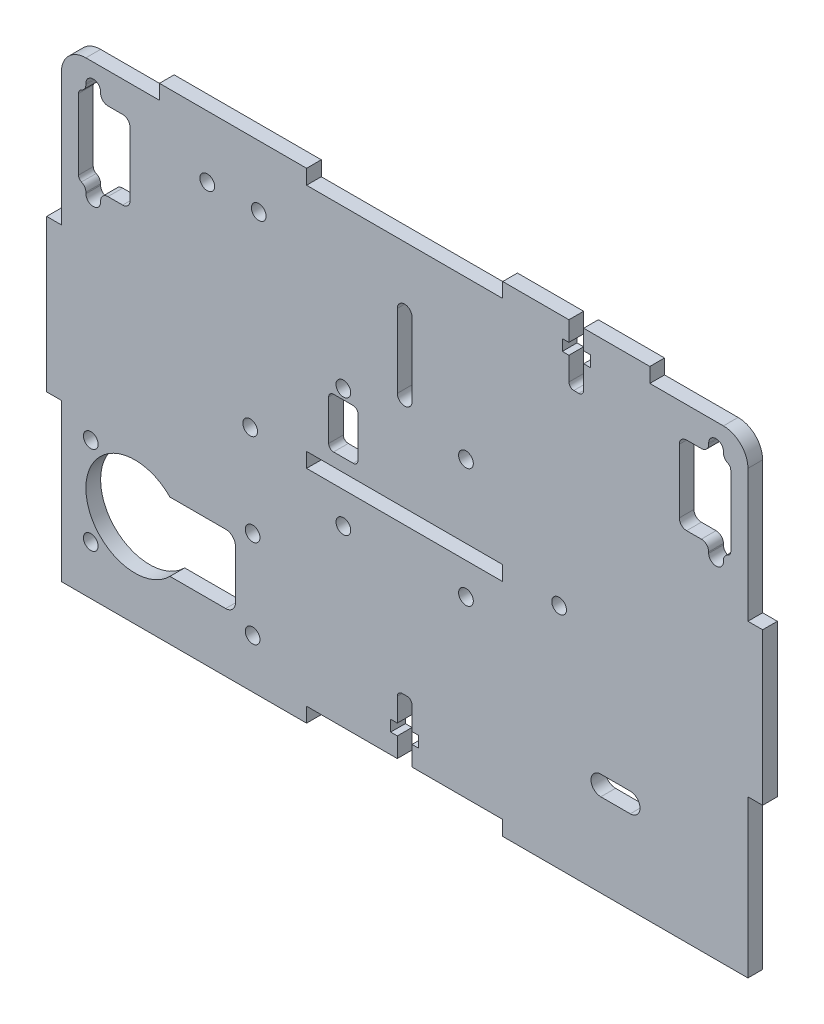
from build123d import *

# Parameters (mm, degrees)
ESBO_O1_W                   = 140
ESBO_O1_H                   = 95
RESSALTO_EXTRUS_O1_DEPTH    = 1.5
ESBO_O2_R                   = 1.5
ESBO_O2_W                   = 40
ESBO_O2_H                   = 3
CORTE_EXTRUS_O1_DEPTH       = 85.647799735
CUT_EXTRUDE12_DEPTH         = 85.607919251
CUT_EXTRUDE12_DEPTH_BACK    = 85.607919251
ESBO_O3_W                   = 3
ESBO_O3_H                   = 31
ESBO_O3_W_2                 = 30
ESBO_O3_H_2                 = 3
RESSALTO_EXTRUS_O2_DEPTH    = 3
CORTE_EXTRUS_O11_DEPTH      = 89.815820663
CORTE_EXTRUS_O11_DEPTH_BACK = 89.815820663
CORTE_EXTRUS_O2_DEPTH       = 89.815820663
CORTE_EXTRUS_O12_DEPTH      = 89.815820663
CORTE_EXTRUS_O12_DEPTH_BACK = 89.815820663
ESBO_O31_R                  = 1.5
CUT_EXTRUDE11_DEPTH         = 89.815820663
CUT_EXTRUDE11_DEPTH_BACK    = 89.815820663
CUT_EXTRUDE14_DEPTH         = 89.777812543
CUT_EXTRUDE14_DEPTH_BACK    = 89.777812543
CUT_EXTRUDE15_DEPTH         = 89.815820663
CUT_EXTRUDE16_DEPTH         = 89.777812543
CUT_EXTRUDE16_DEPTH_BACK    = 89.777812543
SKETCH13_R                  = 1.5
FILLET1_R                   = 5
CUT_EXTRUDE17_DEPTH         = 89.777812543
CUT_EXTRUDE17_DEPTH_BACK    = 89.777812543
SKETCH14_R                  = 1.5


with BuildPart() as part:
    # Esboço1 → Ressalto-extrusão1 (new, symmetric)
    with BuildSketch(Plane.XY):
        Rectangle(ESBO_O1_W, ESBO_O1_H)
    extrude(amount=RESSALTO_EXTRUS_O1_DEPTH, both=True)

    # Esboço2 → Corte-extrusão1 (cut, through all)
    with BuildSketch(Plane.XY.offset(1.5)):
        with Locations((-31.5, -1)):
            Circle(ESBO_O2_R)
        with Locations(Location((31.5, -1, 0), (0, 0, 180))):
            Circle(ESBO_O2_R)
        with Locations((0, -46)):
            Rectangle(ESBO_O2_W, ESBO_O2_H)
        with Locations((0, -1)):
            Rectangle(ESBO_O2_W, ESBO_O2_H)
    extrude(amount=-CORTE_EXTRUS_O1_DEPTH, mode=Mode.SUBTRACT)

    # Sketch9 → Cut-Extrude12 (cut, two sides: drawn at the far end of the back side and taken through both)
    with BuildSketch(Plane.XY.offset(-CUT_EXTRUDE12_DEPTH_BACK)):
        with BuildLine():
            Line((-1.5, -44.5), (1.5, -44.5))
            Line((1.5, -44.5), (1.5, -40.5))
            Line((1.5, -40.5), (2.85, -40.5))
            Line((2.85, -40.5), (2.85, -38.23))
            Line((2.85, -38.23), (1.5, -38.23))
            Line((1.5, -38.23), (1.5, -33.5))
            ThreePointArc((1.5, -33.5), (1.207106781, -32.792893219), (0.5, -32.5))
            Line((0.5, -32.5), (-0.5, -32.5))
            ThreePointArc((-0.5, -32.5), (-1.207106781, -32.792893219), (-1.5, -33.5))
            Line((-1.5, -33.5), (-1.5, -38.23))
            Line((-1.5, -38.23), (-2.85, -38.23))
            Line((-2.85, -38.23), (-2.85, -40.5))
            Line((-2.85, -40.5), (-1.5, -40.5))
            Line((-1.5, -40.5), (-1.5, -44.5))
        make_face()
    extrude(amount=CUT_EXTRUDE12_DEPTH + CUT_EXTRUDE12_DEPTH_BACK, mode=Mode.SUBTRACT)

    # Esboço3 → Ressalto-extrusão2 (add, through all)
    with BuildSketch(Plane.XY.offset(1.5)):
        with Locations((71.5, 0)):
            Rectangle(ESBO_O3_W, ESBO_O3_H)
        with Locations((-71.5, 0)):
            Rectangle(ESBO_O3_W, ESBO_O3_H)
        with Locations((-35, 49)):
            Rectangle(ESBO_O3_W_2, ESBO_O3_H_2)
        with Locations((35, 49)):
            Rectangle(ESBO_O3_W_2, ESBO_O3_H_2)
    extrude(amount=-RESSALTO_EXTRUS_O2_DEPTH)

    # Esboço30 → Corte-extrusão11 (cut, two sides: drawn at the far end of the back side and taken through both)
    with BuildSketch(Plane(origin=(0, 0, -1.5), x_dir=(-1, 0, 0), z_dir=(0, 0, -1)).offset(-CORTE_EXTRUS_O11_DEPTH_BACK)):
        with BuildLine():
            Line((36.5, -21.5), (47.858571571, -21.5))
            ThreePointArc((47.858571571, -21.5), (65, -28.5), (47.858571571, -35.5))
            Line((47.858571571, -35.5), (36.5, -35.5))
            ThreePointArc((36.5, -35.5), (35.085786438, -34.914213562), (34.5, -33.5))
            Line((34.5, -33.5), (34.5, -23.5))
            ThreePointArc((34.5, -23.5), (35.085786438, -22.085786438), (36.5, -21.5))
        make_face()
    extrude(amount=CORTE_EXTRUS_O11_DEPTH + CORTE_EXTRUS_O11_DEPTH_BACK, mode=Mode.SUBTRACT)

    # Esboço4 → Corte-extrusão2 (cut, through all)
    with BuildSketch(Plane.XY.offset(1.5)):
        with BuildLine():
            Line((40, -26.5), (46, -26.5))
            ThreePointArc((46, -26.5), (48, -28.5), (46, -30.5))
            Line((46, -30.5), (40, -30.5))
            ThreePointArc((40, -30.5), (38, -28.5), (40, -26.5))
        make_face()
    extrude(amount=-CORTE_EXTRUS_O2_DEPTH, mode=Mode.SUBTRACT)

    # Esboço31 → Corte-extrusão12 (cut, two sides: drawn at the far end of the back side and taken through both)
    with BuildSketch(Plane(origin=(0, 0, -1.5), x_dir=(-1, 0, 0), z_dir=(0, 0, -1)).offset(-CORTE_EXTRUS_O12_DEPTH_BACK)):
        with Locations((64, -19.5)):
            Circle(ESBO_O31_R)
        with Locations((64, -37.5)):
            Circle(ESBO_O31_R)
        with Locations((31, -19.5)):
            Circle(ESBO_O31_R)
        with Locations((31, -37.5)):
            Circle(ESBO_O31_R)
    extrude(amount=CORTE_EXTRUS_O12_DEPTH + CORTE_EXTRUS_O12_DEPTH_BACK, mode=Mode.SUBTRACT)

    # Sketch8 → Cut-Extrude11 (cut, two sides: drawn at the far end of the back side and taken through both)
    with BuildSketch(Plane(origin=(0, 0, -1.5), x_dir=(-1, 0, 0), z_dir=(0, 0, -1)).offset(-CUT_EXTRUDE11_DEPTH_BACK)):
        with BuildLine():
            Line((-56, 39.75), (-56, 26.75))
            ThreePointArc((-56, 26.75), (-56.439339828, 25.689339828), (-57.5, 25.25))
            Line((-57.5, 25.25), (-60.5, 25.25))
            ThreePointArc((-60.5, 25.25), (-61.560660172, 24.810660172), (-62, 23.75))
            Line((-62, 23.75), (-62, 23.5))
            ThreePointArc((-62, 23.5), (-63.5, 22), (-65, 23.5))
            Line((-65, 23.5), (-65, 23.75))
            ThreePointArc((-65, 23.75), (-65.24500996, 24.571583836), (-65.9, 25.124772708))
            ThreePointArc((-65.9, 25.124772708), (-66.336660027, 25.49356529), (-66.5, 26.041287847))
            Line((-66.5, 26.041287847), (-66.5, 40.458712153))
            ThreePointArc((-66.5, 40.458712153), (-66.336660027, 41.00643471), (-65.9, 41.375227292))
            ThreePointArc((-65.9, 41.375227292), (-65.24500996, 41.928416164), (-65, 42.75))
            Line((-65, 42.75), (-65, 43))
            ThreePointArc((-65, 43), (-63.5, 44.5), (-62, 43))
            Line((-62, 43), (-62, 42.75))
            ThreePointArc((-62, 42.75), (-61.560660172, 41.689339828), (-60.5, 41.25))
            Line((-60.5, 41.25), (-57.5, 41.25))
            ThreePointArc((-57.5, 41.25), (-56.439339828, 40.810660172), (-56, 39.75))
        make_face()
        with BuildLine():
            Line((56, 39.75), (56, 26.75))
            ThreePointArc((56, 26.75), (56.439339828, 25.689339828), (57.5, 25.25))
            Line((57.5, 25.25), (60.5, 25.25))
            ThreePointArc((60.5, 25.25), (61.560660172, 24.810660172), (62, 23.75))
            Line((62, 23.75), (62, 23.5))
            ThreePointArc((62, 23.5), (63.5, 22), (65, 23.5))
            Line((65, 23.5), (65, 23.75))
            ThreePointArc((65, 23.75), (65.24500996, 24.571583836), (65.9, 25.124772708))
            ThreePointArc((65.9, 25.124772708), (66.336660027, 25.49356529), (66.5, 26.041287847))
            Line((66.5, 26.041287847), (66.5, 40.458712153))
            ThreePointArc((66.5, 40.458712153), (66.336660027, 41.00643471), (65.9, 41.375227292))
            ThreePointArc((65.9, 41.375227292), (65.24500996, 41.928416164), (65, 42.75))
            Line((65, 42.75), (65, 43))
            ThreePointArc((65, 43), (63.5, 44.5), (62, 43))
            Line((62, 43), (62, 42.75))
            ThreePointArc((62, 42.75), (61.560660172, 41.689339828), (60.5, 41.25))
            Line((60.5, 41.25), (57.5, 41.25))
            ThreePointArc((57.5, 41.25), (56.439339828, 40.810660172), (56, 39.75))
        make_face()
    extrude(amount=CUT_EXTRUDE11_DEPTH + CUT_EXTRUDE11_DEPTH_BACK, mode=Mode.SUBTRACT)

    # Sketch11 → Cut-Extrude14 (cut, two sides: drawn at the far end of the back side and taken through both)
    with BuildSketch(Plane.XY.offset(-CUT_EXTRUDE14_DEPTH_BACK)):
        with BuildLine():
            Line((33.5, 50.5), (36.5, 50.5))
            Line((36.5, 50.5), (36.5, 46.5))
            Line((36.5, 46.5), (37.85, 46.5))
            Line((37.85, 46.5), (37.85, 44.23))
            Line((37.85, 44.23), (36.5, 44.23))
            Line((36.5, 44.23), (36.5, 39.5))
            ThreePointArc((36.5, 39.5), (36.207106781, 38.792893219), (35.5, 38.5))
            Line((35.5, 38.5), (34.5, 38.5))
            ThreePointArc((34.5, 38.5), (33.792893219, 38.792893219), (33.5, 39.5))
            Line((33.5, 39.5), (33.5, 44.23))
            Line((33.5, 44.23), (32.15, 44.23))
            Line((32.15, 44.23), (32.15, 46.5))
            Line((32.15, 46.5), (33.5, 46.5))
            Line((33.5, 46.5), (33.5, 50.5))
        make_face()
    extrude(amount=CUT_EXTRUDE14_DEPTH + CUT_EXTRUDE14_DEPTH_BACK, mode=Mode.SUBTRACT)

    # Sketch12 → Cut-Extrude15 (cut, through all)
    with BuildSketch(Plane.XY.offset(1.5)):
        with BuildLine():
            Line((-1.5, 20), (-1.5, 35))
            ThreePointArc((-1.5, 35), (0, 36.5), (1.5, 35))
            Line((1.5, 35), (1.5, 20))
            ThreePointArc((1.5, 20), (0, 18.5), (-1.5, 20))
        make_face()
    extrude(amount=-CUT_EXTRUDE15_DEPTH, mode=Mode.SUBTRACT)

    # Sketch13 → Cut-Extrude16 (cut, two sides: drawn at the far end of the back side and taken through both)
    with BuildSketch(Plane.XY.offset(-CUT_EXTRUDE16_DEPTH_BACK)):
        with Locations((12.5, 15.35)):
            Circle(SKETCH13_R)
        with Locations((-12.5, -8.95)):
            Circle(SKETCH13_R)
        with Locations((12.5, -8.95)):
            Circle(SKETCH13_R)
        with Locations((-12.5, 15.35)):
            Circle(SKETCH13_R)
        with BuildLine():
            Line((-10.5, 13.35), (-14.5, 13.35))
            ThreePointArc((-14.5, 13.35), (-15.207106781, 13.057106781), (-15.5, 12.35))
            Line((-15.5, 12.35), (-15.5, 4.15))
            ThreePointArc((-15.5, 4.15), (-15.207106781, 3.442893219), (-14.5, 3.15))
            Line((-14.5, 3.15), (-10.5, 3.15))
            ThreePointArc((-10.5, 3.15), (-9.792893219, 3.442893219), (-9.5, 4.15))
            Line((-9.5, 4.15), (-9.5, 12.35))
            ThreePointArc((-9.5, 12.35), (-9.792893219, 13.057106781), (-10.5, 13.35))
        make_face()
    extrude(amount=CUT_EXTRUDE16_DEPTH + CUT_EXTRUDE16_DEPTH_BACK, mode=Mode.SUBTRACT)

    # Fillet1
    fillet1_edges = [part.edges().sort_by_distance(p)[0] for p in [
        (-70, 47.5, 0),
        (70, 47.5, 0),
    ]]
    fillet(fillet1_edges, radius=FILLET1_R)

    # Sketch14 → Cut-Extrude17 (cut, two sides: drawn at the far end of the back side and taken through both)
    with BuildSketch(Plane.XY.offset(-CUT_EXTRUDE17_DEPTH_BACK)):
        with Locations((-29.75, 37.9)):
            Circle(SKETCH14_R)
        with Locations((-40.25, 37.9)):
            Circle(SKETCH14_R)
    extrude(amount=CUT_EXTRUDE17_DEPTH + CUT_EXTRUDE17_DEPTH_BACK, mode=Mode.SUBTRACT)


solid = part.part
